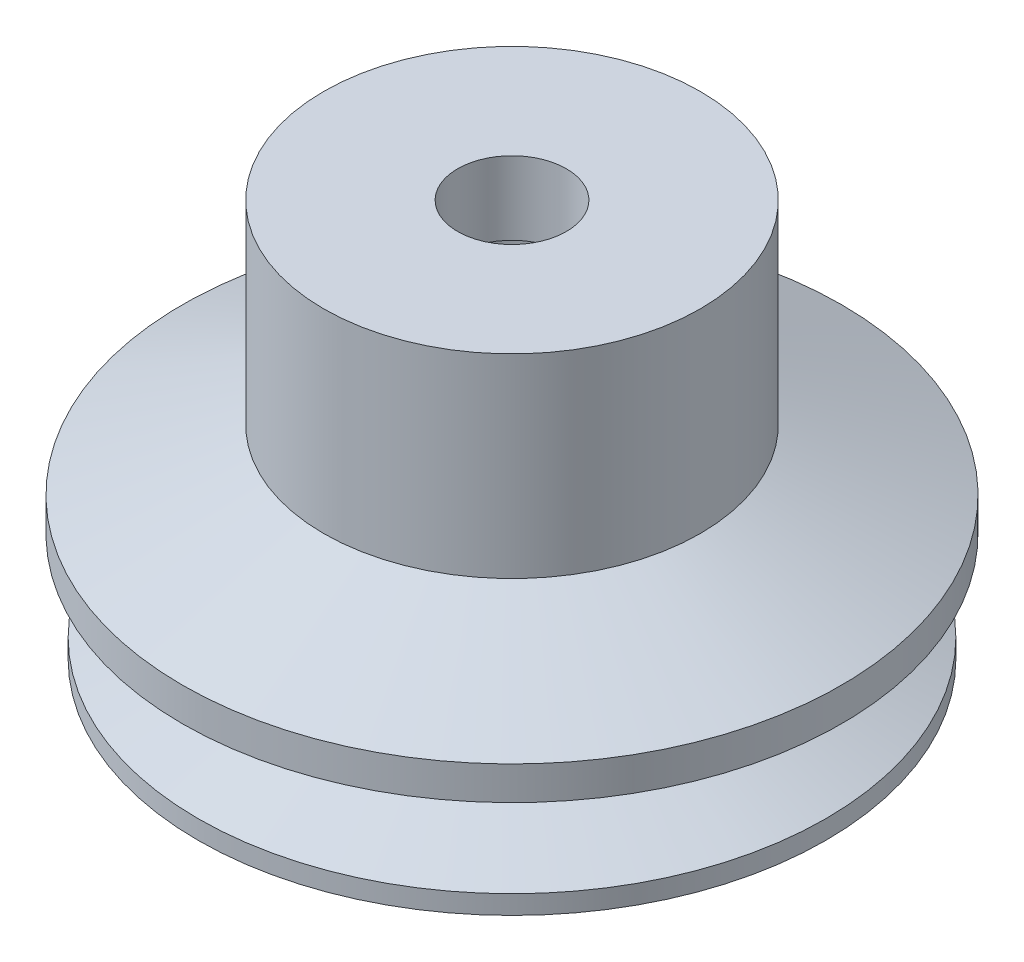
from build123d import *


with BuildPart() as part:
    # Esquisse1 → Révolution1 (revolve)
    with BuildSketch(Plane(origin=(0, 0, 0), x_dir=(0, 0, -1), z_dir=(1, 0, 0)), mode=Mode.PRIVATE) as r_volution1_sk:
        Polygon((-2.6, 19), (-2.6, 15.5), (-3.6, 15.5), (-3.6, 13.5), (-2.55, 13.5), (-2.55, 9), (-7.5, 9), (-13.75, 6), (-7.5, 3.2), (-15, 0), (-15, 0.9), (-9.611144406, 3.2), (-15.75, 5.2), (-15.75, 6.8), (-9, 9.7), (-9, 19), align=None)
    revolve(r_volution1_sk.sketch.rotate(Axis((0, 0, 0), (0, 1, 0)), 180), axis=Axis((0, 0, 0), (0, 1, 0)))


solid = part.part
